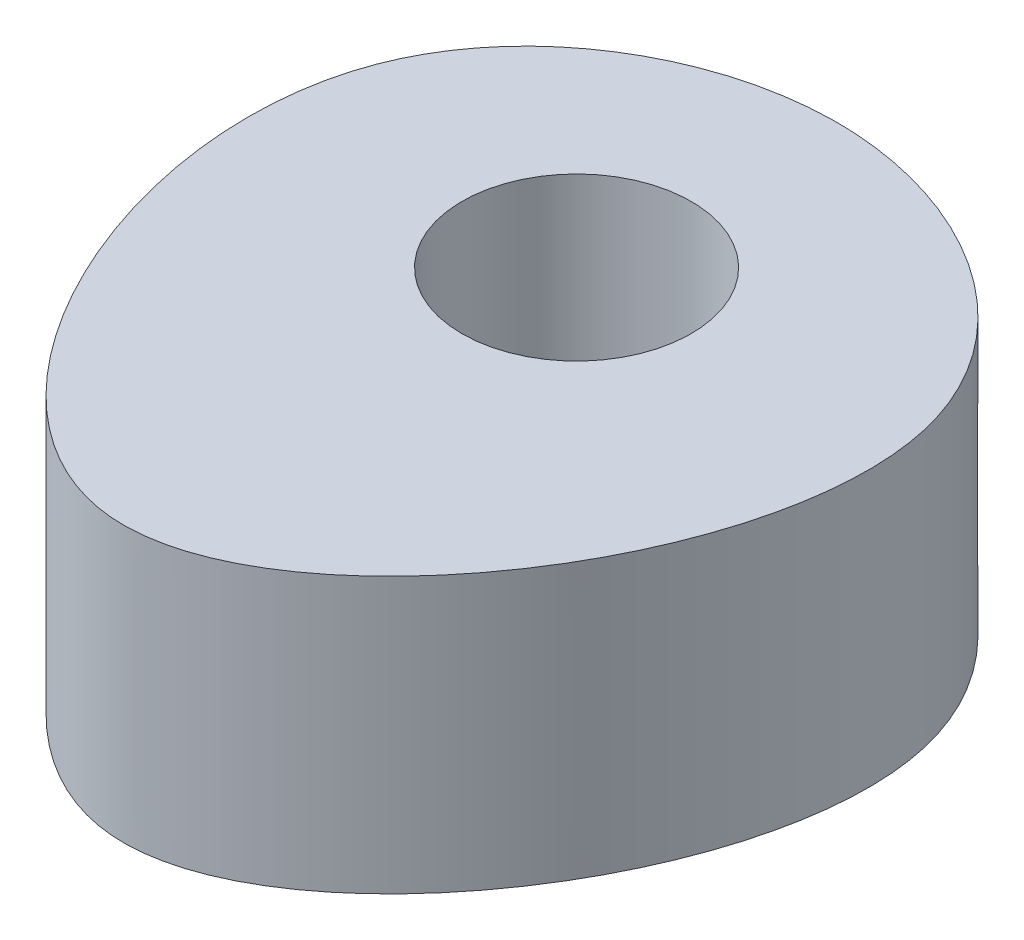
from build123d import *

# Parameters (mm, degrees)
SKETCH1_R           = 12.5
BOSS_EXTRUDE1_DEPTH = 30


with BuildPart() as part:
    # Sketch1 → Boss-Extrude1 (new body)
    with BuildSketch(Plane(origin=(0, 0, 0), x_dir=(1, 0, 0), z_dir=(0, 1, 0))):
        with BuildLine():
            add(Edge.make_bspline(
                [(0, 27.902818267), (-12.865356056, 27.722964416), (-47.951019888, 7.006068316), (-3.585470189, -83.188336694), (54.044384471, 4.070735403), (14.824810361, 28.110064706), (0, 27.902818267)],
                knots=[0, 0, 0, 0, 0.17363152, 0.48663084, 0.799923582, 1, 1, 1, 1], degree=3))
        make_face()
        with Locations(Location((0, 0, 0), (0, 0, 270))):
            Circle(SKETCH1_R, mode=Mode.SUBTRACT)
    extrude(amount=BOSS_EXTRUDE1_DEPTH)


solid = part.part
